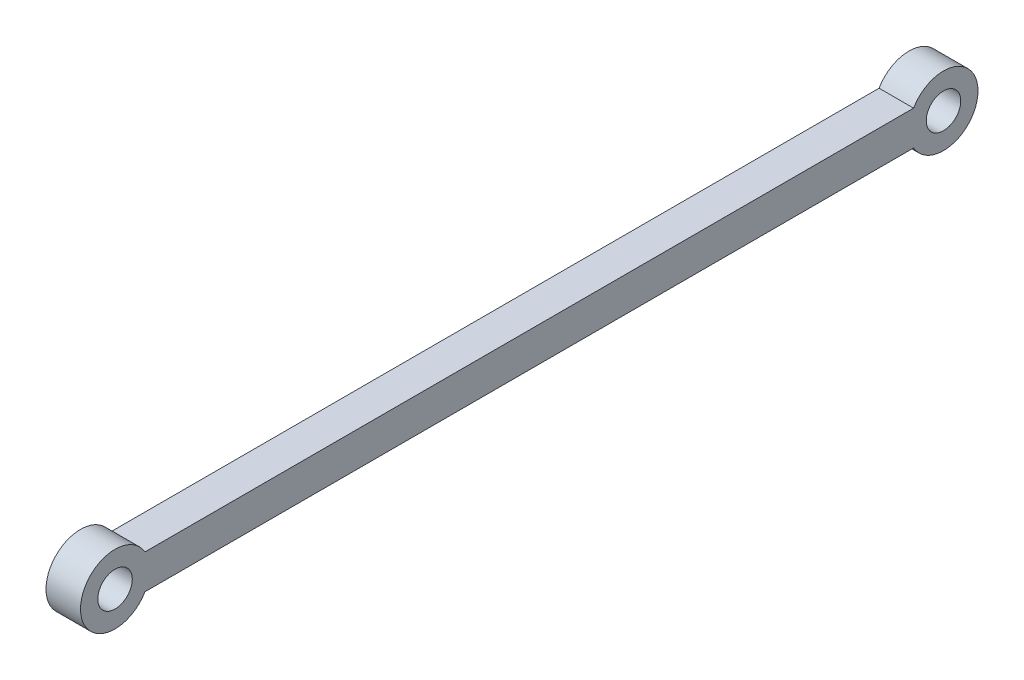
from build123d import *

# Parameters (mm, degrees)
SKETCH_1_R      = 1.25
EXTRUDE_1_DEPTH = 2.5


with BuildPart() as part:
    # 스케치1 → 보스-돌출1 (new body)
    with BuildSketch(Plane(origin=(0, 0, 0), x_dir=(0, 0, -1), z_dir=(1, 0, 0))):
        with BuildLine():
            Line((-27.834936491, 1.25), (27.834936491, 1.25))
            ThreePointArc((27.834936491, 1.25), (32.5, 0), (27.834936491, -1.25))
            Line((27.834936491, -1.25), (-27.834936491, -1.25))
            ThreePointArc((-27.834936491, -1.25), (-32.5, 0), (-27.834936491, 1.25))
        make_face()
        with Locations((-30, 0)):
            Circle(SKETCH_1_R, mode=Mode.SUBTRACT)
        with Locations((30, 0)):
            Circle(SKETCH_1_R, mode=Mode.SUBTRACT)
    extrude(amount=EXTRUDE_1_DEPTH)


solid = part.part
